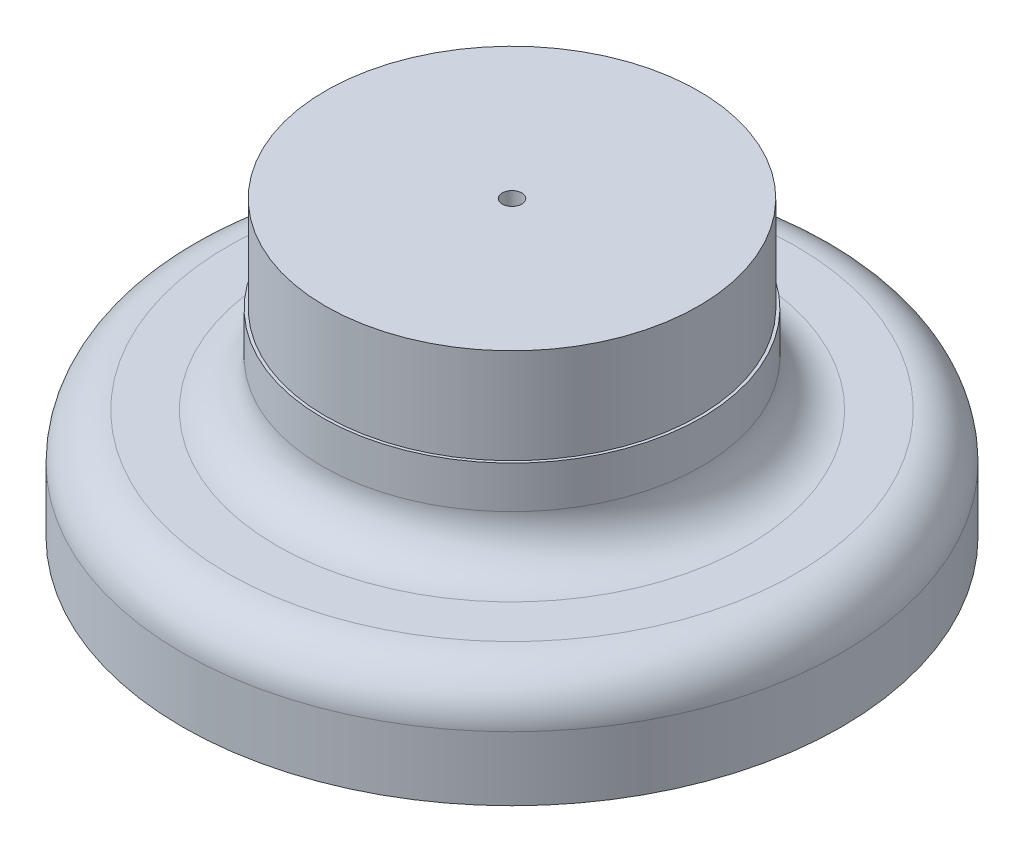
from build123d import *

# Parameters (mm, degrees)
SKETCH1_R                                           = 114.3
SKETCH1_R_2                                         = 65.7225
BOSS_EXTRUDE1_DEPTH                                 = 38.1
SKETCH1_3_R                                         = 65.7225
SKETCH1_3_R_2                                       = 64.7065
BOSS_EXTRUDE2_DEPTH                                 = 68.58
SKETCH1_4_R                                         = 64.7065
BOSS_EXTRUDE3_DEPTH                                 = 101.6
CSK_FOR_1_4_FLAT_HEAD_MACHINE_SCREW_100_D           = 6.7564
CSK_FOR_1_4_FLAT_HEAD_MACHINE_SCREW_100_CSINK_D     = 12.8778
CSK_FOR_1_4_FLAT_HEAD_MACHINE_SCREW_100_CSINK_ANGLE = 100
FILLET1_R                                           = 15.875
FILLET2_R                                           = 15.875


with BuildPart() as part:
    # Sketch1 → Boss-Extrude1 (new body)
    with BuildSketch(Plane(origin=(0, 0, 0), x_dir=(1, 0, 0), z_dir=(0, 1, 0))):
        Circle(SKETCH1_R)
        Circle(SKETCH1_R_2, mode=Mode.SUBTRACT)
    extrude(amount=BOSS_EXTRUDE1_DEPTH)

    # Sketch1<3> → Boss-Extrude2 (add)
    with BuildSketch(Plane(origin=(0, 0, 0), x_dir=(1, 0, 0), z_dir=(0, 1, 0))):
        Circle(SKETCH1_3_R)
        Circle(SKETCH1_3_R_2, mode=Mode.SUBTRACT)
    extrude(amount=BOSS_EXTRUDE2_DEPTH)

    # Sketch1<4> → Boss-Extrude3 (add)
    with BuildSketch(Plane(origin=(0, 0, 0), x_dir=(1, 0, 0), z_dir=(0, 1, 0))):
        Circle(SKETCH1_4_R)
    extrude(amount=BOSS_EXTRUDE3_DEPTH)

    # CSK for 1/4 Flat Head Machine Screw (100)1 (through all)
    with Locations(Plane(origin=(0, 0, 0), x_dir=(-1, 0, 0), z_dir=(0, -1, 0))):
        with Locations((0, 0)):
            CounterSinkHole(CSK_FOR_1_4_FLAT_HEAD_MACHINE_SCREW_100_D / 2, CSK_FOR_1_4_FLAT_HEAD_MACHINE_SCREW_100_CSINK_D / 2, counter_sink_angle=CSK_FOR_1_4_FLAT_HEAD_MACHINE_SCREW_100_CSINK_ANGLE)

    # Fillet1
    fillet1_edges = [part.edges().sort_by_distance(p)[0] for p in [
        (-65.7225, 38.1, 0),
    ]]
    fillet(fillet1_edges, radius=FILLET1_R)

    # Fillet2
    fillet2_edges = [part.edges().sort_by_distance(p)[0] for p in [
        (-114.3, 38.1, 0),
    ]]
    fillet(fillet2_edges, radius=FILLET2_R)


solid = part.part
